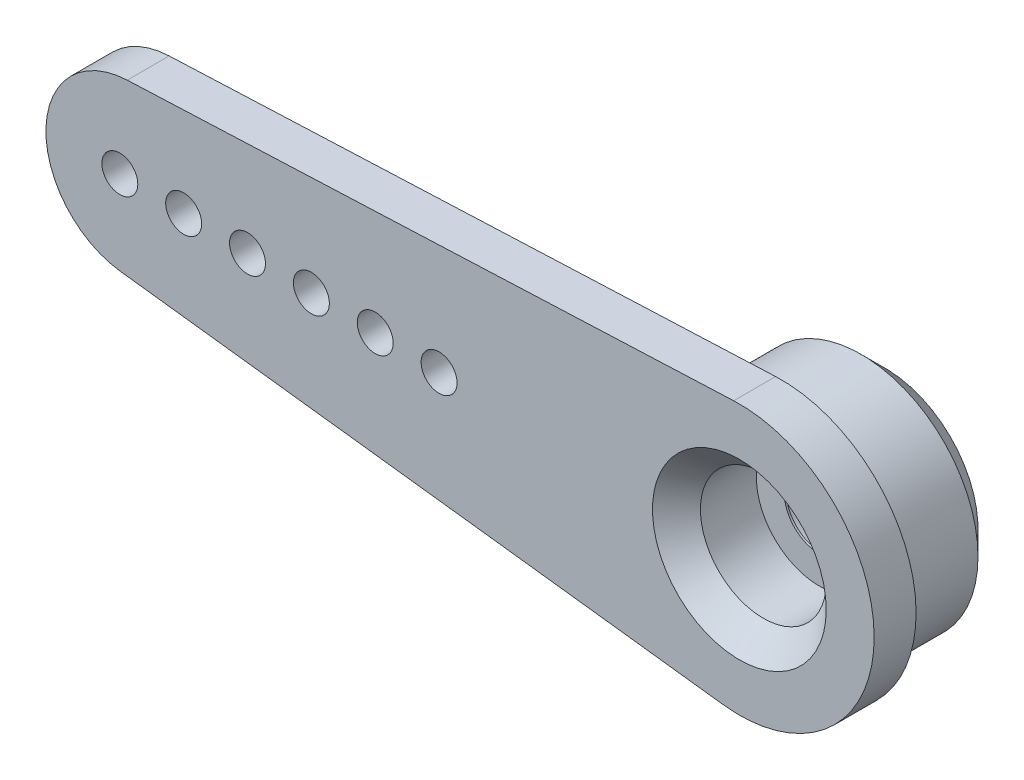
from build123d import *

# Parameters (mm, degrees)
EXTRUSION1_DEPTH           = 2.1
ESQUISSE2_R                = 5.85
EXTRUSION2_DEPTH           = 5.2
ESQUISSE3_R                = 1.75
EXTRUSION3_DEPTH           = 39.762384708
ESQUISSE4_R                = 3.15
EXTRUSION4_DEPTH           = 4
ESQUISSE5_R                = 2.95
EXTRUSION5_DEPTH           = 3.2
CHANFREIN2_SIZE            = 1.2
D_GAGEMENT_M21_D           = 1.8
R_P_TITION_LIN_AIRE1_COUNT = 6
R_P_TITION_LIN_AIRE1_PITCH = 3.2


with BuildPart() as part:
    # Esquisse1 → Extrusion1 (new body)
    with BuildSketch(Plane.XY):
        with BuildLine():
            Line((-0.179008677, 4.246228432), (30.191384159, 5.526556123))
            ThreePointArc((30.191384159, 5.526556123), (37.220312431, -1.486890222), (29.654324486, -7.917293686))
            Line((29.654324486, -7.917293686), (-0.51715736, -4.218417744))
            ThreePointArc((-0.51715736, -4.218417744), (-4.246612828, 0.169645193), (-0.179008677, 4.246228432))
        make_face()
    extrude(amount=EXTRUSION1_DEPTH)

    # Esquisse2 → Extrusion2 (add)
    with BuildSketch(Plane(origin=(0, 0, 0), x_dir=(-1, 0, 0), z_dir=(0, 0, -1))):
        with Locations((-30.475692058, -1.217453739)):
            Circle(ESQUISSE2_R)
    extrude(amount=EXTRUSION2_DEPTH)

    # Esquisse3 → Extrusion3 (cut, through all)
    with BuildSketch(Plane(origin=(0, 0, -5.2), x_dir=(-1, 0, 0), z_dir=(0, 0, -1))):
        with Locations((-30.475692058, -1.217453739)):
            Circle(ESQUISSE3_R)
    extrude(amount=-EXTRUSION3_DEPTH, mode=Mode.SUBTRACT)

    # Esquisse4 → Extrusion4 (cut)
    with BuildSketch(Plane.XY.offset(2.1)):
        with Locations((30.475692058, -1.217453739)):
            Circle(ESQUISSE4_R)
    extrude(amount=-EXTRUSION4_DEPTH, mode=Mode.SUBTRACT)

    # Esquisse5 → Extrusion5 (cut)
    with BuildSketch(Plane(origin=(0, 0, -5.2), x_dir=(-1, 0, 0), z_dir=(0, 0, -1))):
        with Locations((-30.475692058, -1.217453739)):
            Circle(ESQUISSE5_R)
    extrude(amount=-EXTRUSION5_DEPTH, mode=Mode.SUBTRACT)

    # Chanfrein2
    chanfrein2_edges = [part.edges().sort_by_distance(p)[0] for p in [
        (27.325692058, -1.217453739, 2.1),
        (36.325692058, -1.217453739, -5.2),
    ]]
    chamfer(chanfrein2_edges, length=CHANFREIN2_SIZE)

    # Dégagement M21 (through all)
    with Locations(Plane(origin=(-0.55, 0, 2.1), x_dir=(1, 0, 0), z_dir=(0, 0, 1))):
        with Locations((0, 0)):
            d_gagement_m21 = Hole(D_GAGEMENT_M21_D / 2)

    # Répétition linéaire1: Dégagement M21 ×6
    with Locations(*[Vector(0.9992309921094119, -0.0392100039280862, 0) * (i * R_P_TITION_LIN_AIRE1_PITCH) for i in range(1, R_P_TITION_LIN_AIRE1_COUNT)]):
        add(d_gagement_m21, mode=Mode.SUBTRACT)


solid = part.part
